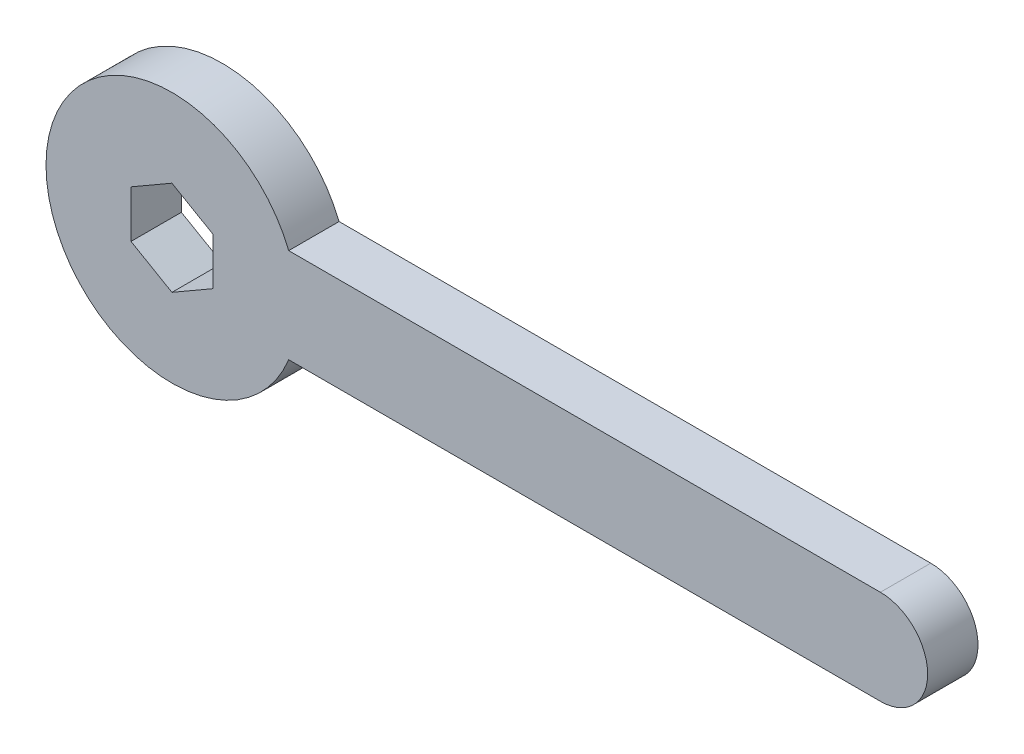
from build123d import *

# Parameters (mm, degrees)
SKETCH_1_R          = 20
EXTRUDE_1_DEPTH     = 8
EXTRUDE_3_DEPTH     = 8
CUT_EXTRUDE_2_DEPTH = 122.918005233


with BuildPart() as part:
    # 草图1 → 凸台-拉伸1 (new body)
    with BuildSketch(Plane.XY):
        Circle(SKETCH_1_R)
    extrude(amount=EXTRUDE_1_DEPTH)

    # 草图4 → 凸台-拉伸3 (add)
    with BuildSketch(Plane.XY):
        with BuildLine():
            Line((0, -7.5), (112.5, -7.5))
            ThreePointArc((112.5, -7.5), (120, 0), (112.5, 7.5))
            Line((112.5, 7.5), (0, 7.5))
            ThreePointArc((0, 7.5), (-7.5, 0), (0, -7.5))
        make_face()
    extrude(amount=EXTRUDE_3_DEPTH)

    # 草图5 → 切除-拉伸2 (cut, through all)
    with BuildSketch(Plane.XY):
        Polygon((6.5, 3.75277675), (0, 7.505553499), (-6.5, 3.75277675), (-6.5, -3.75277675), (0, -7.505553499), (6.5, -3.75277675), align=None)
    extrude(amount=CUT_EXTRUDE_2_DEPTH, mode=Mode.SUBTRACT)


solid = part.part
